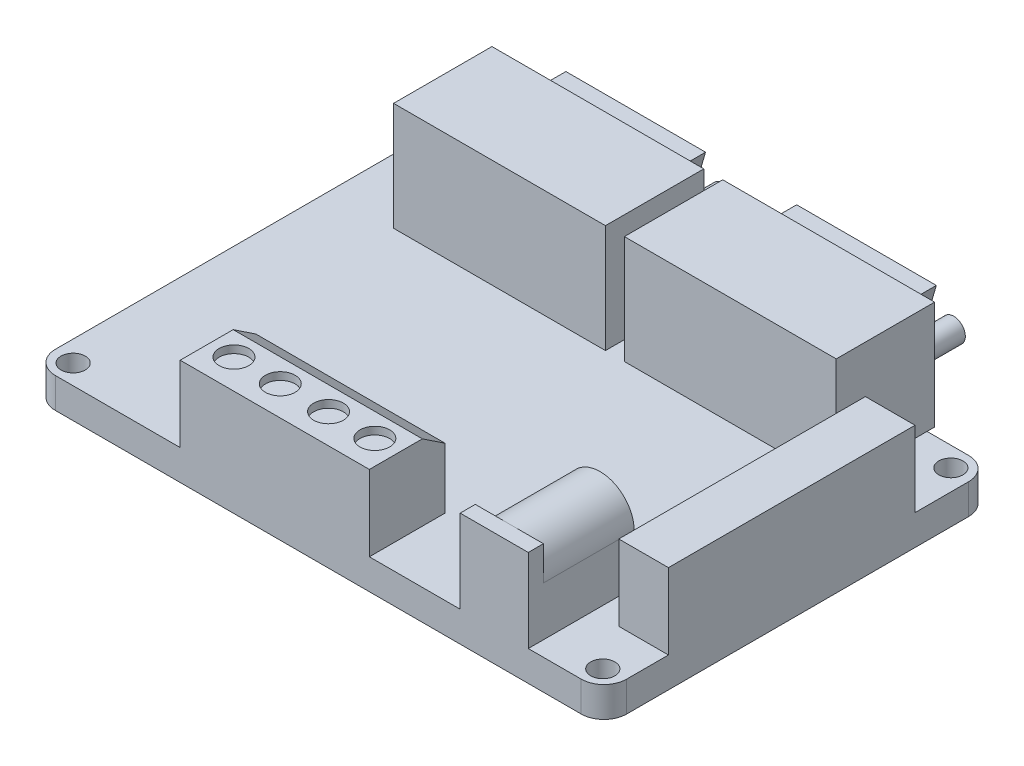
from build123d import *

# Parameters (mm, degrees)
SKETCH_1_W          = 75.5
SKETCH_1_H          = 51.2
EXTRUDE_1_DEPTH     = 4
HOLE_WIZARD_M3_1_D  = 3.2
FILLET_1_R          = 3
SKETCH_4_W          = 9
SKETCH_4_H          = 11
EXTRUDE_2_DEPTH     = 14
CUT_EXTRUDE_1_DEPTH = 12
SKETCH_6_W          = 25
SKETCH_6_H          = 10
EXTRUDE_3_DEPTH     = 10
SKETCH_7_R          = 1.963016799
CUT_EXTRUDE_2_DEPTH = 1
CHAMFER_1_SIZE      = 2
CHAMFER_1_SIZE2     = 3
SKETCH_8_W          = 6.560594773
SKETCH_8_H          = 32.588402295
EXTRUDE_4_DEPTH     = 10
SKETCH_9_W          = 28
SKETCH_9_H          = 18
EXTRUDE_5_DEPTH     = 14.3
SKETCH_10_W         = 28
SKETCH_10_H         = 14.3
SKETCH_10_R         = 1.542197262
CUT_EXTRUDE_3_DEPTH = 5


with BuildPart() as part:
    # 草图1 → 凸台-拉伸1 (new body)
    with BuildSketch(Plane(origin=(0, 0, 0), x_dir=(1, 0, 0), z_dir=(0, 1, 0))):
        Rectangle(SKETCH_1_W, SKETCH_1_H)
    extrude(amount=EXTRUDE_1_DEPTH)

    # M3 间隙孔1 (through all)
    with Locations(Plane(origin=(0, 4, 0), x_dir=(1, 0, 0), z_dir=(0, 1, 0))):
        with Locations((-35, 23), (35, 23), (-35, -23), (35, -23)):
            Hole(HOLE_WIZARD_M3_1_D / 2)

    # 圆角1
    fillet_1_edges = [part.edges().sort_by_distance(p)[0] for p in [
        (-37.75, 2, -25.6),
        (37.75, 2, -25.6),
        (37.75, 2, 25.6),
        (-37.75, 2, 25.6),
    ]]
    fillet(fillet_1_edges, radius=FILLET_1_R)

    # 草图4 → 凸台-拉伸2 (add)
    with BuildSketch(Plane.XY.offset(25.6)):
        with Locations((23.25, 9.5)):
            Rectangle(SKETCH_4_W, SKETCH_4_H)
    extrude(amount=-EXTRUDE_2_DEPTH)

    # 草图5 → 切除-拉伸1 (cut)
    with BuildSketch(Plane(origin=(0, 0, 11.6), x_dir=(-1, 0, 0), z_dir=(0, 0, -1))):
        with BuildLine():
            Line((-27.75, 10.5), (-28.75, 10.5))
            Line((-28.75, 10.5), (-28.75, 16))
            Line((-28.75, 16), (-17.75, 16))
            Line((-17.75, 16), (-17.75, 10.5))
            Line((-17.75, 10.5), (-18.75, 10.5))
            ThreePointArc((-18.75, 10.5), (-23.25, 15), (-27.75, 10.5))
        make_face()
    extrude(amount=-CUT_EXTRUDE_1_DEPTH, mode=Mode.SUBTRACT)

    # 草图6 → 凸台-拉伸3 (add)
    with BuildSketch(Plane(origin=(0, 4, 0), x_dir=(1, 0, 0), z_dir=(0, 1, 0))):
        with Locations((-5.75, -20.6)):
            Rectangle(SKETCH_6_W, SKETCH_6_H)
    extrude(amount=EXTRUDE_3_DEPTH)

    # 草图7 → 切除-拉伸2 (cut)
    with BuildSketch(Plane(origin=(0, 14, 0), x_dir=(1, 0, 0), z_dir=(0, 1, 0))):
        with Locations(Location((-15.05979197, -21.684454558, 0), (0, 0, 270))):
            Circle(SKETCH_7_R)
        with Locations(Location((-8.94020803, -21.684454558, 0), (0, 0, 90))):
            Circle(SKETCH_7_R)
        with Locations(Location((3.55979197, -21.684454558, 0), (0, 0, 90))):
            Circle(SKETCH_7_R)
        with Locations(Location((-2.55979197, -21.684454558, 0), (0, 0, 270))):
            Circle(SKETCH_7_R)
    extrude(amount=-CUT_EXTRUDE_2_DEPTH, mode=Mode.SUBTRACT)

    # 倒角1
    chamfer_1_edges = [part.edges().sort_by_distance(p)[0] for p in [
        (-5.75, 14, 15.6),
    ]]
    chamfer_1_side = [part.faces().sort_by_distance(p)[0] for p in [
        (-5.75, 9, 15.6),
    ]]
    chamfer(chamfer_1_edges, length=CHAMFER_1_SIZE, length2=CHAMFER_1_SIZE2, reference=chamfer_1_side[0])

    # 草图8 → 凸台-拉伸4 (add)
    with BuildSketch(Plane(origin=(0, 4, 0), x_dir=(1, 0, 0), z_dir=(0, 1, 0))):
        with Locations((34.469702614, -0.78179248)):
            Rectangle(SKETCH_8_W, SKETCH_8_H)
    extrude(amount=EXTRUDE_4_DEPTH)

    # 草图9 → 凸台-拉伸5 (add)
    with BuildSketch(Plane(origin=(0, 4, 0), x_dir=(1, 0, 0), z_dir=(0, 1, 0))):
        with Locations((-15.25, 22.6)):
            Rectangle(SKETCH_9_W, SKETCH_9_H)
        with Locations((15.25, 22.6)):
            Rectangle(SKETCH_9_W, SKETCH_9_H)
    extrude(amount=EXTRUDE_5_DEPTH)

    # 草图10 → 切除-拉伸3 (cut)
    # profile 1 of 2: a face of its own
    with BuildSketch(Plane(origin=(0, 0, -31.6), x_dir=(-1, 0, 0), z_dir=(0, 0, -1))):
        with Locations((-15.25, 11.15)):
            Rectangle(SKETCH_10_W, SKETCH_10_H)
        with Locations((-26.769914648, 11.409080509)):
            Circle(SKETCH_10_R, mode=Mode.SUBTRACT)
        with Locations((-3.730085352, 11.409080509)):
            Circle(SKETCH_10_R, mode=Mode.SUBTRACT)
        Polygon((-22.404607637, 8.177619476), (-8.095392363, 8.177619476), (-6.020301502, 15.325154661), (-24.479698498, 15.325154661), align=None, mode=Mode.SUBTRACT)
    # profile 2 of 2: a face of its own
    with BuildSketch(Plane(origin=(0, 0, -31.6), x_dir=(-1, 0, 0), z_dir=(0, 0, -1))):
        with Locations((15.25, 11.15)):
            Rectangle(SKETCH_10_W, SKETCH_10_H)
        with Locations((3.730085352, 11.409080509)):
            Circle(SKETCH_10_R, mode=Mode.SUBTRACT)
        with Locations((26.769914648, 11.409080509)):
            Circle(SKETCH_10_R, mode=Mode.SUBTRACT)
        Polygon((6.020301502, 15.325154661), (8.095392363, 8.177619476), (22.404607637, 8.177619476), (24.479698498, 15.325154661), align=None, mode=Mode.SUBTRACT)
    extrude(amount=-CUT_EXTRUDE_3_DEPTH, mode=Mode.SUBTRACT)


solid = part.part
